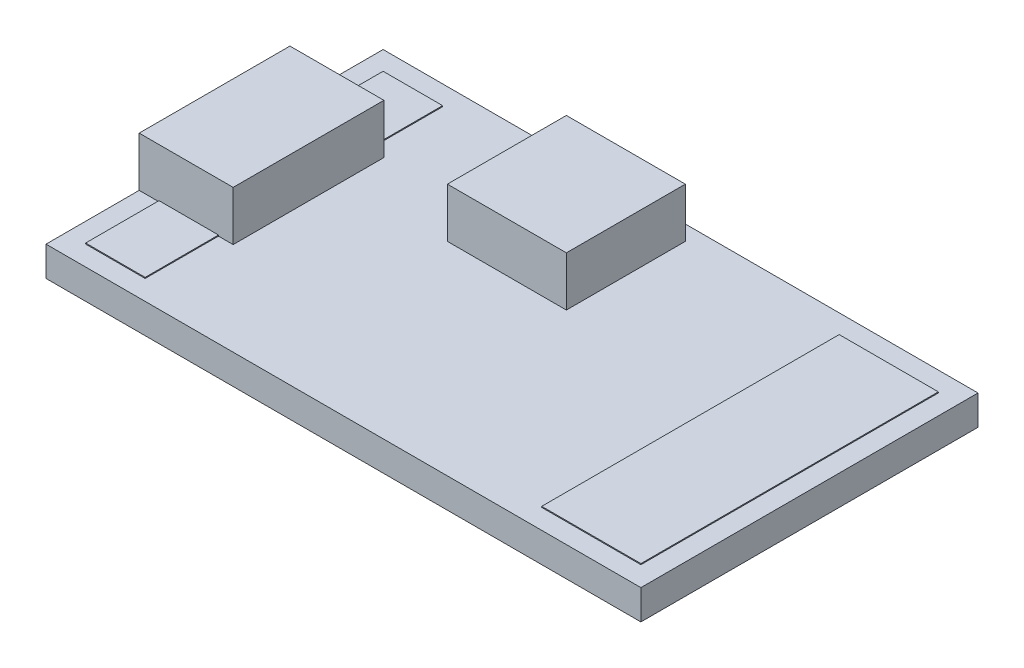
from build123d import *

# Parameters (mm, degrees)
SKETCH_1_W      = 30
SKETCH_1_H      = 17
EXTRUDE_1_DEPTH = 1.5
SKETCH_4_W      = 6
SKETCH_4_H      = 6
SKETCH_4_W_2    = 4.739464385
SKETCH_4_H_2    = 7.603341308
EXTRUDE_3_DEPTH = 4
SKETCH_6_W      = 5
SKETCH_6_H      = 15
SKETCH_6_W_2    = 3
EXTRUDE_4_DEPTH = 1.55


with BuildPart() as part:
    # Эскиз1 → Бобышка-Вытянуть1 (new body)
    with BuildSketch(Plane(origin=(0, 0, 0), x_dir=(1, 0, 0), z_dir=(0, 1, 0))):
        with Locations((-15, 0)):
            Rectangle(SKETCH_1_W, SKETCH_1_H)
    extrude(amount=EXTRUDE_1_DEPTH)

    # Эскиз4 → Бобышка-Вытянуть3 (add)
    with BuildSketch(Plane(origin=(0, 0, 0), x_dir=(1, 0, 0), z_dir=(0, 1, 0))):
        with Locations((-17, 4.741395497)):
            Rectangle(SKETCH_4_W, SKETCH_4_H)
        with Locations((-27.630267808, 0)):
            Rectangle(SKETCH_4_W_2, SKETCH_4_H_2)
    extrude(amount=EXTRUDE_3_DEPTH)

    # Эскиз6 → Бобышка-Вытянуть4 (add)
    with BuildSketch(Plane(origin=(0, 0, 0), x_dir=(1, 0, 0), z_dir=(0, 1, 0))):
        with Locations((-3.5, 0)):
            Rectangle(SKETCH_6_W, SKETCH_6_H)
        with Locations((-27.5, 0)):
            Rectangle(SKETCH_6_W_2, SKETCH_6_H)
    extrude(amount=EXTRUDE_4_DEPTH)


solid = part.part
